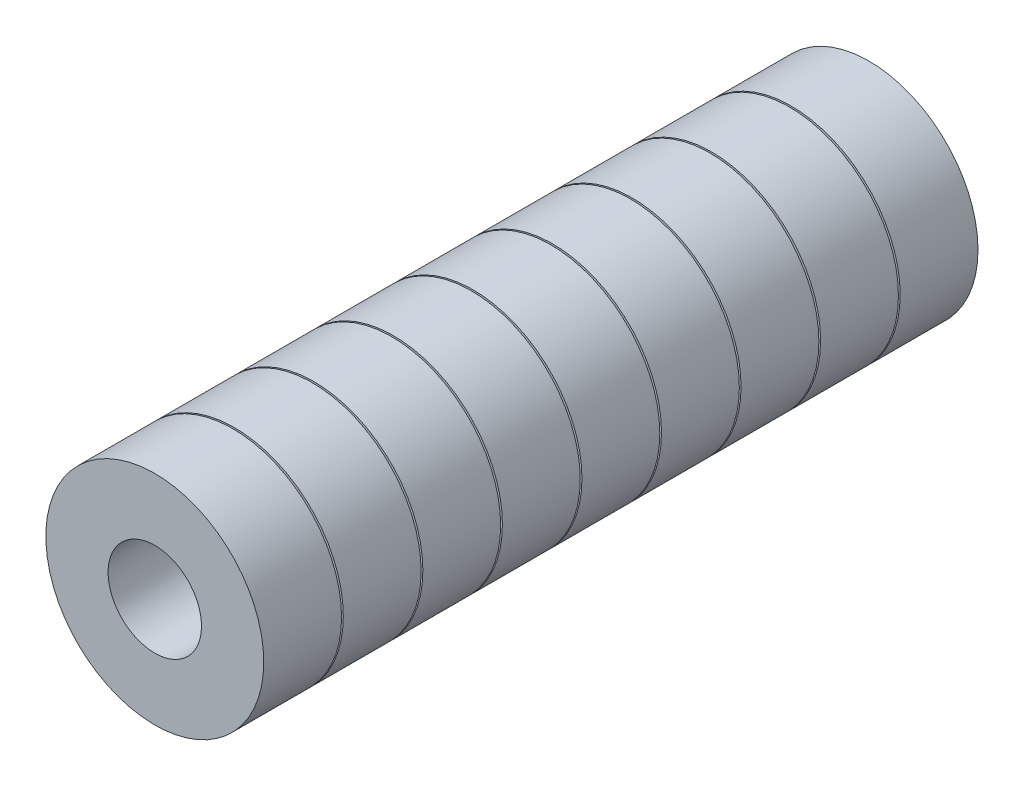
from build123d import *

# Parameters (mm, degrees)
SKETCH_1_R             = 3.5
SKETCH_1_R_2           = 1.5
EXTRUDE_1_DEPTH        = 2.5
PATTERN_LINEAR_1_COUNT = 9
PATTERN_LINEAR_1_PITCH = 2.555555556


with BuildPart() as part:
    # 草图1 → 凸台-拉伸1 (new body)
    with BuildSketch(Plane.XY):
        Circle(SKETCH_1_R)
        Circle(SKETCH_1_R_2, mode=Mode.SUBTRACT)
    extrude(amount=EXTRUDE_1_DEPTH)


with BuildPart() as pattern_linear_1_1:
    # 阵列(线性)1: pattern copy
    add(part.part.moved(Location(Vector(0, 0, -1) * (1 * PATTERN_LINEAR_1_PITCH))))


with BuildPart() as pattern_linear_1_2:
    # 阵列(线性)1: pattern copy
    add(part.part.moved(Location(Vector(0, 0, -1) * (2 * PATTERN_LINEAR_1_PITCH))))


with BuildPart() as pattern_linear_1_3:
    # 阵列(线性)1: pattern copy
    add(part.part.moved(Location(Vector(0, 0, -1) * (3 * PATTERN_LINEAR_1_PITCH))))


with BuildPart() as pattern_linear_1_4:
    # 阵列(线性)1: pattern copy
    add(part.part.moved(Location(Vector(0, 0, -1) * (4 * PATTERN_LINEAR_1_PITCH))))


with BuildPart() as pattern_linear_1_5:
    # 阵列(线性)1: pattern copy
    add(part.part.moved(Location(Vector(0, 0, -1) * (5 * PATTERN_LINEAR_1_PITCH))))


with BuildPart() as pattern_linear_1_6:
    # 阵列(线性)1: pattern copy
    add(part.part.moved(Location(Vector(0, 0, -1) * (6 * PATTERN_LINEAR_1_PITCH))))


with BuildPart() as pattern_linear_1_7:
    # 阵列(线性)1: pattern copy
    add(part.part.moved(Location(Vector(0, 0, -1) * (7 * PATTERN_LINEAR_1_PITCH))))


with BuildPart() as pattern_linear_1_8:
    # 阵列(线性)1: pattern copy
    add(part.part.moved(Location(Vector(0, 0, -1) * (8 * PATTERN_LINEAR_1_PITCH))))


solid = Compound([part.part, pattern_linear_1_1.part, pattern_linear_1_2.part, pattern_linear_1_3.part, pattern_linear_1_4.part, pattern_linear_1_5.part, pattern_linear_1_6.part, pattern_linear_1_7.part, pattern_linear_1_8.part])
